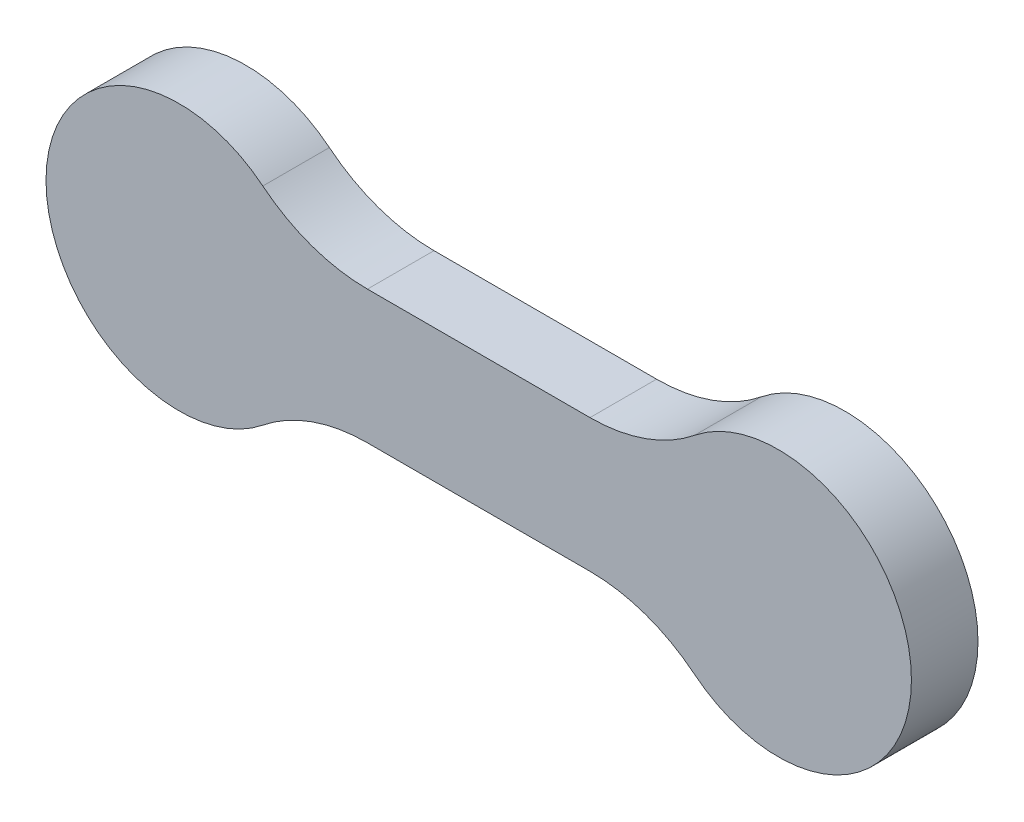
from build123d import *

# Parameters (mm, degrees)
EXTRUDE_1_DEPTH = 20


with BuildPart() as part:
    # 草图1 → 凸台-拉伸1 (new body)
    with BuildSketch(Plane.XY):
        with BuildLine():
            Line((56.568542495, 20), (123.431457505, 20))
            ThreePointArc((123.431457505, 20), (140.098124172, 22.859547921), (154.858425558, 31.111111111))
            ThreePointArc((154.858425558, 31.111111111), (220, 0), (154.858425558, -31.111111111))
            ThreePointArc((154.858425558, -31.111111111), (140.098124172, -22.859547921), (123.431457505, -20))
            Line((123.431457505, -20), (56.568542495, -20))
            ThreePointArc((56.568542495, -20), (39.901875828, -22.859547921), (25.141574442, -31.111111111))
            ThreePointArc((25.141574442, -31.111111111), (-40, 0), (25.141574442, 31.111111111))
            ThreePointArc((25.141574442, 31.111111111), (39.901875828, 22.859547921), (56.568542495, 20))
        make_face()
    extrude(amount=EXTRUDE_1_DEPTH)


solid = part.part
